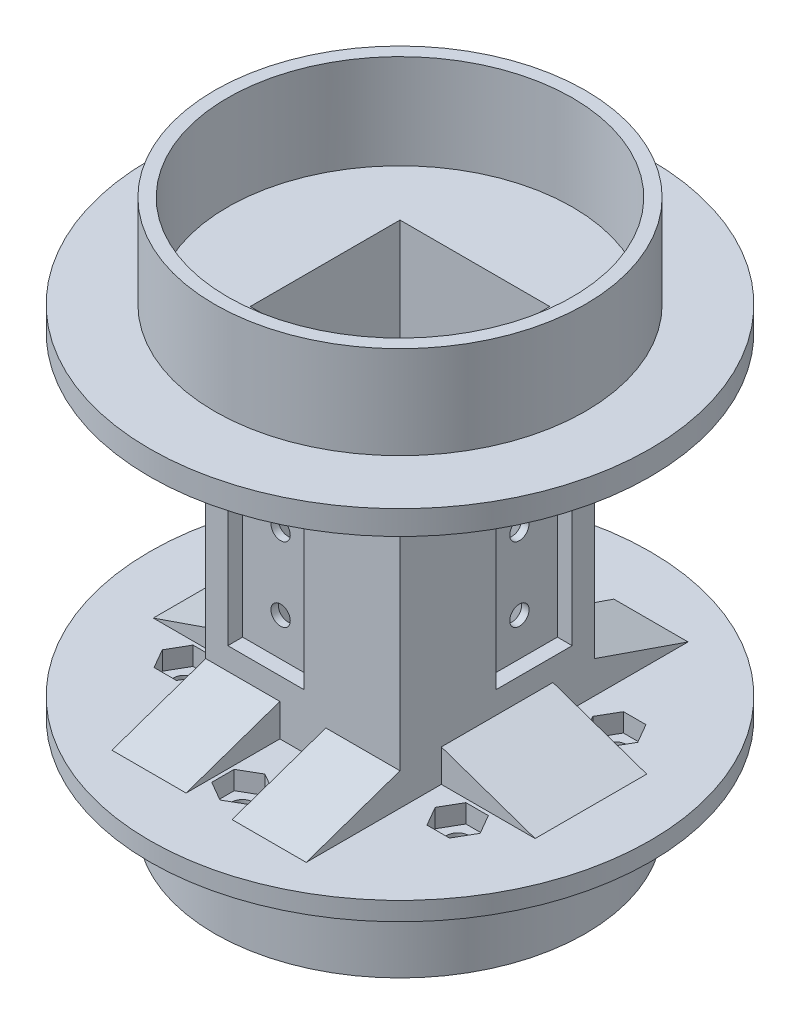
from build123d import *
from build123d.topology import SkipClean

# Parameters (mm, degrees)
SKETCH1_R               = 51.5
SKETCH1_R_2             = 46.5
BOSS_EXTRUDE1_DEPTH     = 41
BOSS_EXTRUDE2_START     = 5
SKETCH2_R               = 75
SKETCH2_R_2             = 46.5
BOSS_EXTRUDE2_DEPTH     = 5
SKETCH3_R               = 46.5
BOSS_EXTRUDE3_DEPTH     = 5
SKETCH4_W               = 40.4
SKETCH4_H               = 40.4
CUT_EXTRUDE1_DEPTH      = 6
SKETCH5_W               = 52.4
SKETCH5_H               = 52.4
SKETCH5_W_2             = 40.4
SKETCH5_H_2             = 40.4
BOSS_EXTRUDE4_DEPTH     = 80
SKETCH8_W               = 52.4
SKETCH8_H               = 52.4
BOSS_EXTRUDE5_DEPTH     = 5
CUT_EXTRUDE4_START      = -1
SKETCH9_R               = 75
SKETCH9_R_2             = 51.5
CUT_EXTRUDE4_DEPTH      = 1
BOSS_EXTRUDE6_START     = 1
SKETCH10_R              = 75
SKETCH10_W              = 52.4
SKETCH10_H              = 52.4
BOSS_EXTRUDE6_DEPTH     = 1
CUT_EXTRUDE5_DEPTH      = 169.5556288
CUT_EXTRUDE5_DEPTH_BACK = 13
SKETCH11_R              = 51.5
SKETCH11_R_2            = 46.5
SKETCH12_W              = 40.4
SKETCH12_H              = 40.4
CUT_EXTRUDE6_DEPTH      = 1
SKETCH13_W              = 52.4
SKETCH13_H              = 52.4
BOSS_EXTRUDE7_DEPTH     = 1
SKETCH6_W               = 20.5
SKETCH6_H               = 60.5
CUT_EXTRUDE2_DEPTH      = 4
SKETCH7_R               = 2.6
CUT_EXTRUDE3_DEPTH      = 2
SKETCH14_W              = 20.5
SKETCH14_H              = 60.5
CUT_EXTRUDE7_DEPTH      = 4
SKETCH15_R              = 2.6
CUT_EXTRUDE8_DEPTH      = 4
CIRPATTERN1_COUNT       = 2
CIRPATTERN2_COUNT       = 2
CUT_EXTRUDE9_START      = -14
SKETCH16_R              = 75
SKETCH16_R_2            = 67.5
CUT_EXTRUDE9_DEPTH      = 14
BOSS_EXTRUDE8_START     = 5
SKETCH17_R              = 67.5
BOSS_EXTRUDE8_DEPTH     = 5
BOSS_EXTRUDE9_DEPTH     = 52.4
BOSS_EXTRUDE10_DEPTH    = 52.4
BOSS_EXTRUDE11_DEPTH    = 52.4
BOSS_EXTRUDE12_DEPTH    = 52.4
SKETCH27_W              = 11
SKETCH27_H              = 4
SKETCH27_W_2            = 4
SKETCH27_H_2            = 11
CUT_EXTRUDE10_DEPTH     = 20
CUT_EXTRUDE11_START     = -29
SKETCH28_R              = 51.5
SKETCH28_R_2            = 50
CUT_EXTRUDE11_DEPTH     = 29
BOSS_EXTRUDE17_START    = 24
SKETCH29_R              = 50
SKETCH29_R_2            = 45
BOSS_EXTRUDE17_DEPTH    = 24
SKETCH30_W              = 11.5
SKETCH30_H              = 4.5
SKETCH30_W_2            = 11
SKETCH30_H_2            = 4
SKETCH30_W_3            = 4.5
SKETCH30_H_3            = 11.5
SKETCH30_W_4            = 4
SKETCH30_H_4            = 11
CUT_EXTRUDE12_DEPTH     = 10
SKETCH31_W              = 4.5
SKETCH31_H              = 11.5
SKETCH31_W_2            = 11.5
SKETCH31_H_2            = 4.5
CUT_EXTRUDE13_DEPTH     = 10
BOSS_EXTRUDE18_START    = 24
SKETCH33_R              = 45
SKETCH33_R_2            = 35
BOSS_EXTRUDE18_DEPTH    = 24
BOSS_EXTRUDE19_START    = 1.5
SKETCH34_R              = 50
SKETCH34_R_2            = 35
BOSS_EXTRUDE19_DEPTH    = 1.5
SKETCH35_R              = 2.95
CUT_EXTRUDE14_DEPTH     = 45
BOSS_EXTRUDE20_DEPTH    = 20
BOSS_EXTRUDE21_DEPTH    = 20
BOSS_EXTRUDE22_DEPTH    = 15.05
BOSS_EXTRUDE23_DEPTH    = 20
BOSS_EXTRUDE24_DEPTH    = 20
BOSS_EXTRUDE25_DEPTH    = 15.05
CUT_EXTRUDE15_DEPTH     = 5
CUT_EXTRUDE16_START     = -4
SKETCH42_R              = 50
SKETCH42_R_2            = 46.5
CUT_EXTRUDE16_DEPTH     = 4
CUT_EXTRUDE17_START     = -0.5
SKETCH43_R              = 67.5
SKETCH43_R_2            = 50
CUT_EXTRUDE17_DEPTH     = 0.5
SKETCH44_R              = 67.5
SKETCH44_R_2            = 50
BOSS_EXTRUDE26_DEPTH    = 2
SKETCH45_R              = 50
SKETCH45_R_2            = 46.5
BOSS_EXTRUDE27_DEPTH    = 1.5
SKETCH46_W              = 11.5
SKETCH46_H              = 2
SKETCH46_W_2            = 2
SKETCH46_H_2            = 11.5
CUT_EXTRUDE18_DEPTH     = 10


with BuildPart() as part:
    # Sketch1 → Boss-Extrude1 (new body)
    with BuildSketch(Plane(origin=(0, 0, 0), x_dir=(1, 0, 0), z_dir=(0, 1, 0))):
        with Locations(Location((0, 0, 0), (0, 0, 270))):
            Circle(SKETCH1_R)
        with Locations(Location((0, 0, 0), (0, 0, 270))):
            Circle(SKETCH1_R_2, mode=Mode.SUBTRACT)
    extrude(amount=BOSS_EXTRUDE1_DEPTH)

    # Sketch2 → Boss-Extrude2 (add)
    with SkipClean():  # the faces are left unmerged after this step: merging them gives an invalid solid
        with BuildSketch(Plane.XZ.offset(BOSS_EXTRUDE2_START)):
            with Locations(Location((0, 0, 0), (0, 0, 270))):
                Circle(SKETCH2_R)
            with Locations(Location((0, 0, 0), (0, 0, 270))):
                Circle(SKETCH2_R_2, mode=Mode.SUBTRACT)
        extrude(amount=-BOSS_EXTRUDE2_DEPTH)

    # Sketch3 → Boss-Extrude3 (add)
    with BuildSketch(Plane.XZ.offset(5)):
        with Locations(Location((0, 0, 0), (0, 0, 270))):
            Circle(SKETCH3_R)
    extrude(amount=-BOSS_EXTRUDE3_DEPTH)

    # Sketch4 → Cut-Extrude1 (cut)
    with BuildSketch(Plane(origin=(0, 0, 0), x_dir=(1, 0, 0), z_dir=(0, 1, 0))):
        Rectangle(SKETCH4_W, SKETCH4_H)
    extrude(amount=-CUT_EXTRUDE1_DEPTH, mode=Mode.SUBTRACT)

    # Sketch5 → Boss-Extrude4 (add)
    with BuildSketch(Plane.XZ.offset(5)):
        Rectangle(SKETCH5_W, SKETCH5_H)
        Rectangle(SKETCH5_W_2, SKETCH5_H_2, mode=Mode.SUBTRACT)
    extrude(amount=BOSS_EXTRUDE4_DEPTH)

    # Sketch8 → Boss-Extrude5 (add)
    with BuildSketch(Plane.XZ.offset(85)):
        Rectangle(SKETCH8_W, SKETCH8_H)
    extrude(amount=BOSS_EXTRUDE5_DEPTH)

    # Sketch9 → Cut-Extrude4 (cut)
    with BuildSketch(Plane(origin=(0, 0, 0), x_dir=(1, 0, 0), z_dir=(0, 1, 0)).offset(CUT_EXTRUDE4_START)):
        with Locations(Location((0, 0, 0), (0, 0, 270))):
            Circle(SKETCH9_R)
        with Locations(Location((0, 0, 0), (0, 0, 270))):
            Circle(SKETCH9_R_2, mode=Mode.SUBTRACT)
    extrude(amount=CUT_EXTRUDE4_DEPTH, mode=Mode.SUBTRACT)

    # Sketch10 → Boss-Extrude6 (add)
    with BuildSketch(Plane.XZ.offset(5).offset(BOSS_EXTRUDE6_START)):
        with Locations(Location((0, 0, 0), (0, 0, 90))):
            Circle(SKETCH10_R)
        Rectangle(SKETCH10_W, SKETCH10_H, mode=Mode.SUBTRACT)
    extrude(amount=-BOSS_EXTRUDE6_DEPTH)

    # Sketch11 → Cut-Extrude5 (cut, two sides: drawn at the far end of the back side and taken through both)
    with BuildSketch(Plane(origin=(0, 41, 0), x_dir=(1, 0, 0), z_dir=(0, 1, 0)).offset(-CUT_EXTRUDE5_DEPTH_BACK)):
        with Locations(Location((0, 0, 0), (0, 0, 270))):
            Circle(SKETCH11_R)
        with Locations(Location((0, 0, 0), (0, 0, 90))):
            Circle(SKETCH11_R_2, mode=Mode.SUBTRACT)
    extrude(amount=CUT_EXTRUDE5_DEPTH + CUT_EXTRUDE5_DEPTH_BACK, mode=Mode.SUBTRACT)

    # Sketch12 → Cut-Extrude6 (cut)
    with BuildSketch(Plane(origin=(0, -85, 0), x_dir=(1, 0, 0), z_dir=(0, 1, 0))):
        Rectangle(SKETCH12_W, SKETCH12_H)
    extrude(amount=-CUT_EXTRUDE6_DEPTH, mode=Mode.SUBTRACT)

    # Sketch13 → Boss-Extrude7 (add)
    with BuildSketch(Plane.XZ.offset(90)):
        Rectangle(SKETCH13_W, SKETCH13_H)
    extrude(amount=BOSS_EXTRUDE7_DEPTH)

    # Sketch6 → Cut-Extrude2 (cut)
    with BuildSketch(Plane.XY.offset(26.2)):
        with Locations((-10, -46)):
            Rectangle(SKETCH6_W, SKETCH6_H)
    cut_extrude2 = extrude(amount=-CUT_EXTRUDE2_DEPTH, mode=Mode.SUBTRACT)

    # Sketch7 → Cut-Extrude3 (cut)
    with BuildSketch(Plane.XY.offset(22.2)):
        with Locations((-10, -26)):
            Circle(SKETCH7_R)
        with Locations((-10, -46)):
            Circle(SKETCH7_R)
        with Locations((-10, -66)):
            Circle(SKETCH7_R)
    cut_extrude3 = extrude(amount=-CUT_EXTRUDE3_DEPTH, mode=Mode.SUBTRACT)

    # Sketch14 → Cut-Extrude7 (cut)
    with BuildSketch(Plane.ZY.offset(26.2)):
        with Locations((10, -46)):
            Rectangle(SKETCH14_W, SKETCH14_H)
    cut_extrude7 = extrude(amount=-CUT_EXTRUDE7_DEPTH, mode=Mode.SUBTRACT)

    # Sketch15 → Cut-Extrude8 (cut)
    with BuildSketch(Plane.ZY.offset(22.2)):
        with Locations((10, -26)):
            Circle(SKETCH15_R)
        with Locations((10, -46)):
            Circle(SKETCH15_R)
        with Locations((10, -66)):
            Circle(SKETCH15_R)
    cut_extrude8 = extrude(amount=-CUT_EXTRUDE8_DEPTH, mode=Mode.SUBTRACT)

    # CirPattern1: Cut-Extrude2, Cut-Extrude3 ×2 about axis
    cirpattern1_axis = Axis((0, 0, 0), (0, 1, 0))
    add([cut_extrude2.rotate(cirpattern1_axis, i * 360 / CIRPATTERN1_COUNT) for i in range(1, CIRPATTERN1_COUNT)], mode=Mode.SUBTRACT)
    add([cut_extrude3.rotate(cirpattern1_axis, i * 360 / CIRPATTERN1_COUNT) for i in range(1, CIRPATTERN1_COUNT)], mode=Mode.SUBTRACT)

    # CirPattern2: Cut-Extrude7, Cut-Extrude8 ×2 about axis
    cirpattern2_axis = Axis((0, 0, 0), (0, 1, 0))
    add([cut_extrude7.rotate(cirpattern2_axis, i * 360 / CIRPATTERN2_COUNT) for i in range(1, CIRPATTERN2_COUNT)], mode=Mode.SUBTRACT)
    add([cut_extrude8.rotate(cirpattern2_axis, i * 360 / CIRPATTERN2_COUNT) for i in range(1, CIRPATTERN2_COUNT)], mode=Mode.SUBTRACT)

    # Sketch16 → Cut-Extrude9 (cut)
    with BuildSketch(Plane(origin=(0, -1, 0), x_dir=(1, 0, 0), z_dir=(0, 1, 0)).offset(CUT_EXTRUDE9_START)):
        Circle(SKETCH16_R)
        with Locations(Location((0, 0, 0), (0, 0, 270))):
            Circle(SKETCH16_R_2, mode=Mode.SUBTRACT)
    extrude(amount=CUT_EXTRUDE9_DEPTH, mode=Mode.SUBTRACT)

    # Sketch17 → Boss-Extrude8 (add)
    with BuildSketch(Plane.XZ.offset(91).offset(BOSS_EXTRUDE8_START)):
        with Locations(Location((0, 0, 0), (0, 0, 90))):
            Circle(SKETCH17_R)
    extrude(amount=-BOSS_EXTRUDE8_DEPTH)

    # Sketch19 → Boss-Extrude9 (add)
    with BuildSketch(Plane.ZY.offset(26.2)):
        Polygon((26.2, -14.75), (51.5, -6), (26.2, -6), align=None)
    extrude(amount=-BOSS_EXTRUDE9_DEPTH)

    # Sketch20 → Boss-Extrude10 (add)
    with BuildSketch(Plane.XY.offset(26.2)):
        Polygon((-26.2, -14.75), (-51.5, -6), (-26.2, -6), align=None)
    extrude(amount=-BOSS_EXTRUDE10_DEPTH)

    # Sketch21 → Boss-Extrude11 (add)
    with BuildSketch(Plane.ZY.offset(26.2)):
        Polygon((-26.2, -14.75), (-51.5, -6), (-26.2, -6), align=None)
    extrude(amount=-BOSS_EXTRUDE11_DEPTH)

    # Sketch22 → Boss-Extrude12 (add)
    with BuildSketch(Plane(origin=(0, 0, -26.2), x_dir=(-1, 0, 0), z_dir=(0, 0, -1))):
        Polygon((-26.2, -14.75), (-51.5, -6), (-26.2, -6), align=None)
    extrude(amount=-BOSS_EXTRUDE12_DEPTH)

    # Sketch27 → Cut-Extrude10 (cut)
    with BuildSketch(Plane(origin=(0, -86, 0), x_dir=(1, 0, 0), z_dir=(0, 1, 0))):
        with Locations((10, 18.2)):
            Rectangle(SKETCH27_W, SKETCH27_H)
        with Locations((18.2, 10)):
            Rectangle(SKETCH27_W_2, SKETCH27_H_2)
        with Locations((-18.2, -10)):
            Rectangle(SKETCH27_W_2, SKETCH27_H_2)
        with Locations((-10, -18.2)):
            Rectangle(SKETCH27_W, SKETCH27_H)
    extrude(amount=-CUT_EXTRUDE10_DEPTH, mode=Mode.SUBTRACT)

    # Sketch28 → Cut-Extrude11 (cut)
    with BuildSketch(Plane(origin=(0, 28, 0), x_dir=(1, 0, 0), z_dir=(0, 1, 0)).offset(CUT_EXTRUDE11_START)):
        Circle(SKETCH28_R)
        with Locations(Location((0, 0, 0), (0, 0, 270))):
            Circle(SKETCH28_R_2, mode=Mode.SUBTRACT)
    extrude(amount=CUT_EXTRUDE11_DEPTH, mode=Mode.SUBTRACT)

    # Sketch29 → Boss-Extrude17 (add)
    with BuildSketch(Plane.XZ.offset(96).offset(BOSS_EXTRUDE17_START)):
        with Locations(Location((0, 0, 0), (0, 0, 90))):
            Circle(SKETCH29_R)
        with Locations(Location((0, 0, 0), (0, 0, 270))):
            Circle(SKETCH29_R_2, mode=Mode.SUBTRACT)
    extrude(amount=-BOSS_EXTRUDE17_DEPTH)

    # Sketch30 → Cut-Extrude12 (cut)
    # profile 1 of 4: a face of its own
    with BuildSketch(Plane.XZ.offset(96)):
        with Locations((-10, 18.2)):
            Rectangle(SKETCH30_W, SKETCH30_H)
        with Locations((-10, 18.2)):
            Rectangle(SKETCH30_W_2, SKETCH30_H_2, mode=Mode.SUBTRACT)
    # profile 2 of 4: a face of its own
    with BuildSketch(Plane.XZ.offset(96)):
        with Locations((-10, 18.2)):
            Rectangle(SKETCH30_W_2, SKETCH30_H_2)
    # profile 3 of 4: a face of its own
    with BuildSketch(Plane.XZ.offset(96)):
        with Locations((-18.2, 10)):
            Rectangle(SKETCH30_W_3, SKETCH30_H_3)
        with Locations((-18.2, 10)):
            Rectangle(SKETCH30_W_4, SKETCH30_H_4, mode=Mode.SUBTRACT)
    # profile 4 of 4: a face of its own
    with BuildSketch(Plane.XZ.offset(96)):
        with Locations((-18.2, 10)):
            Rectangle(SKETCH30_W_4, SKETCH30_H_4)
    extrude(amount=-CUT_EXTRUDE12_DEPTH, mode=Mode.SUBTRACT)

    # Sketch31 → Cut-Extrude13 (cut)
    with BuildSketch(Plane.XZ.offset(96)):
        with Locations((18.2, -10)):
            Rectangle(SKETCH31_W, SKETCH31_H)
        with Locations((10, -18.2)):
            Rectangle(SKETCH31_W_2, SKETCH31_H_2)
    extrude(amount=-CUT_EXTRUDE13_DEPTH, mode=Mode.SUBTRACT)

    # Sketch33 → Boss-Extrude18 (add)
    with BuildSketch(Plane.XZ.offset(96).offset(BOSS_EXTRUDE18_START)):
        Circle(SKETCH33_R)
        with Locations(Location((0, 0, 0), (0, 0, 270))):
            Circle(SKETCH33_R_2, mode=Mode.SUBTRACT)
    extrude(amount=-BOSS_EXTRUDE18_DEPTH)

    # Sketch34 → Boss-Extrude19 (add)
    with BuildSketch(Plane.XZ.offset(120).offset(BOSS_EXTRUDE19_START)):
        with Locations(Location((0, 0, 0), (0, 0, 90))):
            Circle(SKETCH34_R)
        with Locations(Location((0, 0, 0), (0, 0, 270))):
            Circle(SKETCH34_R_2, mode=Mode.SUBTRACT)
    extrude(amount=-BOSS_EXTRUDE19_DEPTH)

    # Sketch35 → Cut-Extrude14 (cut)
    with BuildSketch(Plane.XZ.offset(121.5)):
        with Locations(Location((0, 42.5, 0), (0, 0, 270))):
            Circle(SKETCH35_R)
        with Locations(Location((36.806079661, 21.25, 0), (0, 0, 270))):
            Circle(SKETCH35_R)
        with Locations(Location((36.806079661, -21.25, 0), (0, 0, 270))):
            Circle(SKETCH35_R)
        with Locations(Location((0, -42.5, 0), (0, 0, 270))):
            Circle(SKETCH35_R)
        with Locations(Location((-36.806079661, -21.25, 0), (0, 0, 270))):
            Circle(SKETCH35_R)
        with Locations(Location((-36.806079661, 21.25, 0), (0, 0, 270))):
            Circle(SKETCH35_R)
    extrude(amount=-CUT_EXTRUDE14_DEPTH, mode=Mode.SUBTRACT)

    # Sketch25 → Boss-Extrude20 (add)
    with BuildSketch(Plane.ZY.offset(26.2)):
        Polygon((-26.2, -82.25), (-51.5, -91), (-26.2, -91), align=None)
    extrude(amount=-BOSS_EXTRUDE20_DEPTH)

    # Sketch37 → Boss-Extrude21 (add)
    with BuildSketch(Plane(origin=(26.2, 0, 0), x_dir=(0, 0, -1), z_dir=(1, 0, 0))):
        Polygon((26.2, -82.25), (26.2, -91), (51.5, -91), align=None)
    extrude(amount=-BOSS_EXTRUDE21_DEPTH)

    # Sketch39 → Boss-Extrude22 (add, symmetric)
    with BuildSketch(Plane(origin=(0, 0, 0), x_dir=(-1, 0, 0), z_dir=(0, 0, -1))):
        Polygon((-51.5, -91), (-26.2, -91), (-26.2, -82.25), align=None)
    extrude(amount=BOSS_EXTRUDE22_DEPTH, both=True)

    # Sketch23 → Boss-Extrude23 (add)
    with BuildSketch(Plane(origin=(26.2, 0, 0), x_dir=(0, 0, -1), z_dir=(1, 0, 0))):
        Polygon((-51.5, -91), (-26.2, -82.25), (-26.2, -91), align=None)
    extrude(amount=-BOSS_EXTRUDE23_DEPTH)

    # Sketch40 → Boss-Extrude24 (add)
    with BuildSketch(Plane.ZY.offset(26.2)):
        Polygon((26.2, -91), (51.5, -91), (26.2, -82.25), align=None)
    extrude(amount=-BOSS_EXTRUDE24_DEPTH)

    # Sketch41 → Boss-Extrude25 (add, symmetric)
    with BuildSketch(Plane.XY):
        Polygon((-51.5, -91), (-26.2, -91), (-26.2, -82.25), align=None)
    extrude(amount=BOSS_EXTRUDE25_DEPTH, both=True)

    # Sketch38 → Cut-Extrude15 (cut)
    with BuildSketch(Plane(origin=(0, -91, 0), x_dir=(1, 0, 0), z_dir=(0, 1, 0))):
        Polygon((39.837168574, -16), (33.774990748, -16), (30.743901834, -21.25), (33.774990748, -26.5), (39.837168574, -26.5), (42.868257487, -21.25), align=None)
        Polygon((39.837168574, 26.5), (33.774990748, 26.5), (30.743901834, 21.25), (33.774990748, 16), (39.837168574, 16), (42.868257487, 21.25), align=None)
        Polygon((5.25, -45.531088913), (5.25, -39.468911087), (0, -36.437822174), (-5.25, -39.468911087), (-5.25, -45.531088913), (0, -48.562177826), align=None)
        Polygon((-39.837168574, -26.5), (-33.774990748, -26.5), (-30.743901834, -21.25), (-33.774990748, -16), (-39.837168574, -16), (-42.868257487, -21.25), align=None)
        Polygon((-39.837168574, 16), (-33.774990748, 16), (-30.743901834, 21.25), (-33.774990748, 26.5), (-39.837168574, 26.5), (-42.868257487, 21.25), align=None)
        Polygon((0, 48.562177826), (-5.25, 45.531088913), (-5.25, 39.468911087), (0, 36.437822174), (5.25, 39.468911087), (5.25, 45.531088913), align=None)
    extrude(amount=-CUT_EXTRUDE15_DEPTH, mode=Mode.SUBTRACT)

    # Sketch42 → Cut-Extrude16 (cut)
    with BuildSketch(Plane(origin=(0, 28, 0), x_dir=(1, 0, 0), z_dir=(0, 1, 0)).offset(CUT_EXTRUDE16_START)):
        with Locations(Location((0, 0, 0), (0, 0, 270))):
            Circle(SKETCH42_R)
        with Locations(Location((0, 0, 0), (0, 0, 90))):
            Circle(SKETCH42_R_2, mode=Mode.SUBTRACT)
    extrude(amount=CUT_EXTRUDE16_DEPTH, mode=Mode.SUBTRACT)

    # Sketch43 → Cut-Extrude17 (cut)
    with BuildSketch(Plane(origin=(0, -1, 0), x_dir=(1, 0, 0), z_dir=(0, 1, 0)).offset(CUT_EXTRUDE17_START)):
        with Locations(Location((0, 0, 0), (0, 0, 270))):
            Circle(SKETCH43_R)
        with Locations(Location((0, 0, 0), (0, 0, 270))):
            Circle(SKETCH43_R_2, mode=Mode.SUBTRACT)
    extrude(amount=CUT_EXTRUDE17_DEPTH, mode=Mode.SUBTRACT)

    # Sketch44 → Boss-Extrude26 (add)
    with BuildSketch(Plane(origin=(0, -1.5, 0), x_dir=(1, 0, 0), z_dir=(0, 1, 0))):
        with Locations(Location((0, 0, 0), (0, 0, 270))):
            Circle(SKETCH44_R)
        with Locations(Location((0, 0, 0), (0, 0, 270))):
            Circle(SKETCH44_R_2, mode=Mode.SUBTRACT)
    extrude(amount=BOSS_EXTRUDE26_DEPTH)

    # Sketch45 → Boss-Extrude27 (add)
    with BuildSketch(Plane(origin=(0, 24, 0), x_dir=(1, 0, 0), z_dir=(0, 1, 0))):
        with Locations(Location((0, 0, 0), (0, 0, 270))):
            Circle(SKETCH45_R)
        with Locations(Location((0, 0, 0), (0, 0, 90))):
            Circle(SKETCH45_R_2, mode=Mode.SUBTRACT)
    extrude(amount=BOSS_EXTRUDE27_DEPTH)

    # Sketch46 → Cut-Extrude18 (cut)
    with BuildSketch(Plane.XZ.offset(96)):
        with Locations((-10, 14.95)):
            Rectangle(SKETCH46_W, SKETCH46_H)
        with Locations((-14.95, 10)):
            Rectangle(SKETCH46_W_2, SKETCH46_H_2)
        with Locations((10, -14.95)):
            Rectangle(SKETCH46_W, SKETCH46_H)
        with Locations((14.95, -10)):
            Rectangle(SKETCH46_W_2, SKETCH46_H_2)
    extrude(amount=-CUT_EXTRUDE18_DEPTH, mode=Mode.SUBTRACT)


solid = part.part
